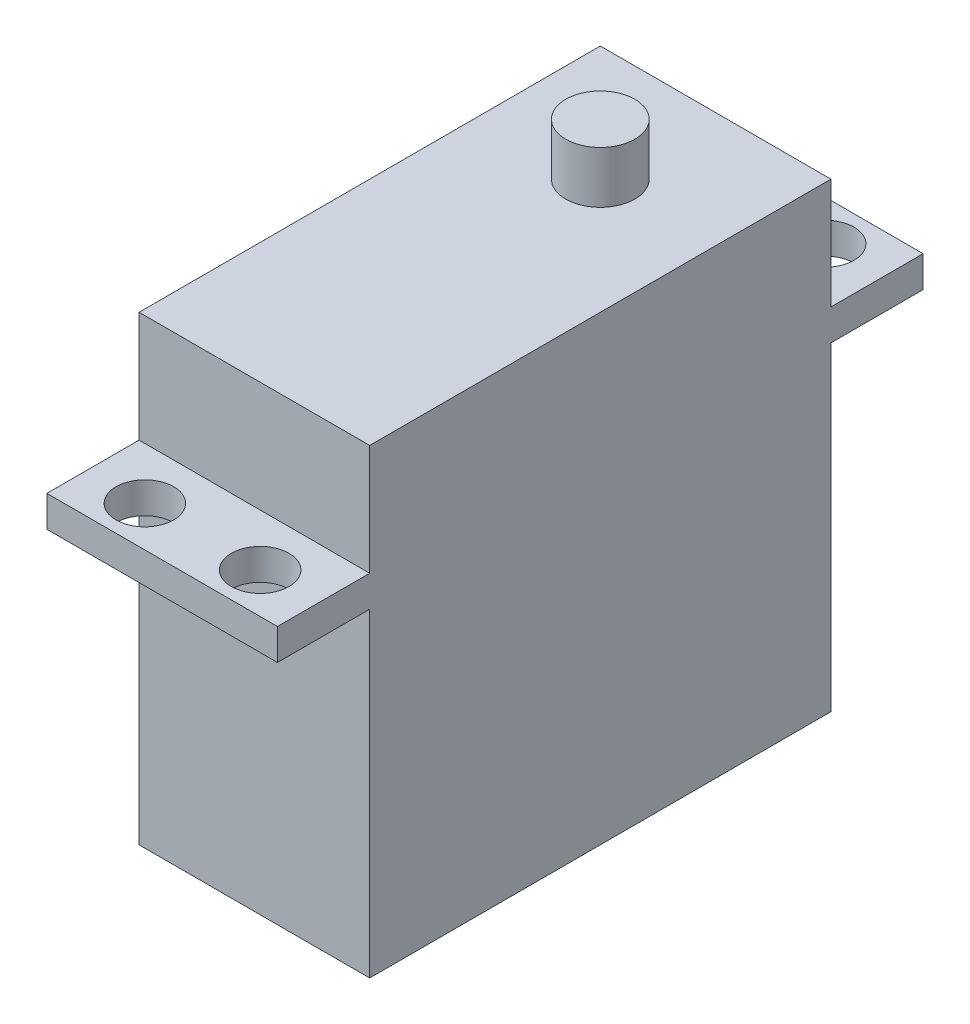
from build123d import *

# Parameters (mm, degrees)
SKETCH_1_W          = 20
SKETCH_1_H          = 40
EXTRUDE_1_DEPTH     = 40
SKETCH_3_W          = 8
SKETCH_3_H          = 2.7
EXTRUDE_2_DEPTH     = 20
SKETCH_4_R          = 2.5
CUT_EXTRUDE_1_DEPTH = 40
SKETCH_5_R          = 3
EXTRUDE_3_DEPTH     = 4.5


with BuildPart() as part:
    # 草圖1 → 填料-伸長1 (new body)
    with BuildSketch(Plane(origin=(0, 0, 0), x_dir=(1, 0, 0), z_dir=(0, 1, 0))):
        Rectangle(SKETCH_1_W, SKETCH_1_H)
    extrude(amount=EXTRUDE_1_DEPTH)

    # 草圖3 → 填料-伸長2 (add)
    with BuildSketch(Plane(origin=(10, 0, 0), x_dir=(0, 0, -1), z_dir=(1, 0, 0))):
        with Locations((24, 29.05)):
            Rectangle(SKETCH_3_W, SKETCH_3_H)
        with Locations((-24, 29.05)):
            Rectangle(SKETCH_3_W, SKETCH_3_H)
    extrude(amount=-EXTRUDE_2_DEPTH)

    # 草圖4 → 除料-伸長1 (cut)
    with BuildSketch(Plane(origin=(0, 30.4, 0), x_dir=(1, 0, 0), z_dir=(0, 1, 0))):
        with Locations(Location((5, 24.5, 0), (0, 0, 270))):
            Circle(SKETCH_4_R)
        with Locations(Location((-5, 24.5, 0), (0, 0, 270))):
            Circle(SKETCH_4_R)
        with Locations(Location((-5, -24.5, 0), (0, 0, 90))):
            Circle(SKETCH_4_R)
        with Locations(Location((5, -24.5, 0), (0, 0, 90))):
            Circle(SKETCH_4_R)
    extrude(amount=-CUT_EXTRUDE_1_DEPTH, mode=Mode.SUBTRACT)

    # 草圖5 → 填料-伸長3 (add)
    with BuildSketch(Plane(origin=(0, 40, 0), x_dir=(1, 0, 0), z_dir=(0, 1, 0))):
        with Locations(Location((0, 10, 0), (0, 0, 270))):
            Circle(SKETCH_5_R)
    extrude(amount=EXTRUDE_3_DEPTH)


solid = part.part
